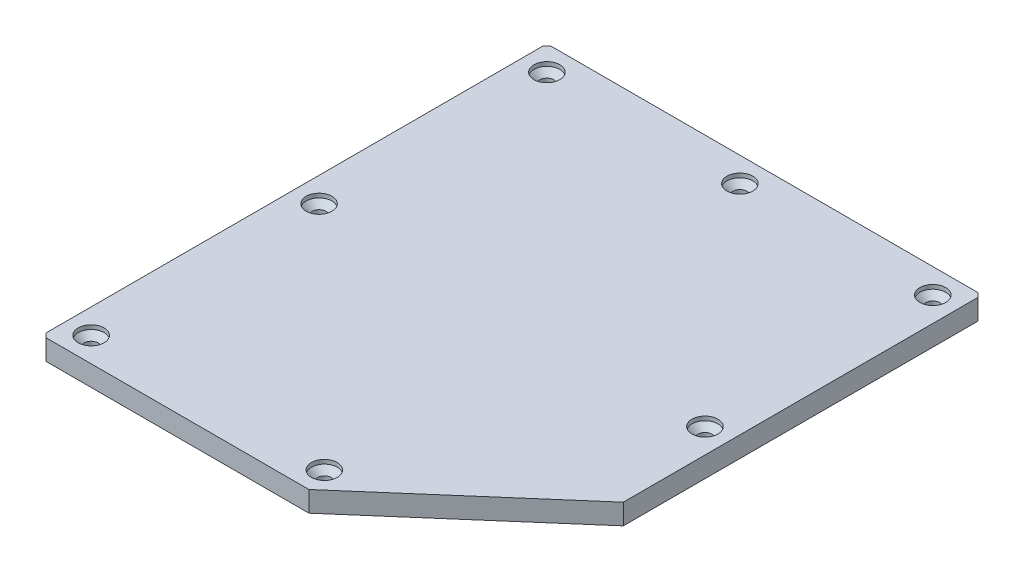
from build123d import *

# Parameters (mm, degrees)
BOSS_EXTRUDE1_DEPTH                          = 5
CSK_FOR_M3_COUNTERSUNK_FLAT_HEAD_SCR_2_COUNT = 2
CSK_FOR_M3_COUNTERSUNK_FLAT_HEAD_SCR_2_PITCH = 47
CSK_FOR_M3_COUNTERSUNK_FLAT_HEAD_SCR_3_COUNT = 2
CSK_FOR_M3_COUNTERSUNK_FLAT_HEAD_SCR_3_PITCH = 94
CSK_FOR_M3_COUNTERSUNK_FLAT_HEAD_SCR_4_COUNT = 2
CSK_FOR_M3_COUNTERSUNK_FLAT_HEAD_SCR_4_PITCH = 109.16157749
CSK_FOR_M3_COUNTERSUNK_FLAT_HEAD_SCR_5_COUNT = 2
CSK_FOR_M3_COUNTERSUNK_FLAT_HEAD_SCR_5_PITCH = 124.687328624
CSK_FOR_M3_COUNTERSUNK_FLAT_HEAD_SCR_6_COUNT = 2
CSK_FOR_M3_COUNTERSUNK_FLAT_HEAD_SCR_6_PITCH = 111
CSK_FOR_M3_COUNTERSUNK_FLAT_HEAD_SCR_7_COUNT = 2
CSK_FOR_M3_COUNTERSUNK_FLAT_HEAD_SCR_7_PITCH = 55.5


with BuildPart() as part:
    # block_perimeter → Boss-Extrude1 (new body)
    with BuildSketch(Plane(origin=(0, 0, 0), x_dir=(1, 0, 0), z_dir=(0, 1, 0))):
        Polygon((52, 60.5), (-52, 60.5), (-53, 59.5), (-53, -61.5), (-52, -62.5), (12.040578429, -62.5), (53, -26.89451804), (53, 59.5), align=None)
    extrude(amount=BOSS_EXTRUDE1_DEPTH)

    # Sketch5 → CSK for M3 Countersunk Flat Head Screw1 (revolve, cut)
    with BuildSketch(Plane(origin=(-47, 5, -54.5), x_dir=(0, 0, 1), z_dir=(1, 0, 0))):
        Polygon((0, 0), (0, 5), (1.7, 5), (1.7, 2.45), (3.15, 1), (3.15, 0), align=None)
    csk_for_m3_countersunk_flat_head_screw1 = revolve(axis=Axis((-47, 11.35, -54.5), (0, -1, 0)), mode=Mode.SUBTRACT)

    # CSK for M3 Countersunk Flat Head Scr 2: CSK for M3 Countersunk Flat Head Screw1 ×2
    with Locations(*[(i * CSK_FOR_M3_COUNTERSUNK_FLAT_HEAD_SCR_2_PITCH, 0, 0) for i in range(1, CSK_FOR_M3_COUNTERSUNK_FLAT_HEAD_SCR_2_COUNT)]):
        add(csk_for_m3_countersunk_flat_head_screw1, mode=Mode.SUBTRACT)

    # CSK for M3 Countersunk Flat Head Scr 3: CSK for M3 Countersunk Flat Head Screw1 ×2
    with Locations(*[(i * CSK_FOR_M3_COUNTERSUNK_FLAT_HEAD_SCR_3_PITCH, 0, 0) for i in range(1, CSK_FOR_M3_COUNTERSUNK_FLAT_HEAD_SCR_3_COUNT)]):
        add(csk_for_m3_countersunk_flat_head_screw1, mode=Mode.SUBTRACT)

    # CSK for M3 Countersunk Flat Head Scr 4: CSK for M3 Countersunk Flat Head Screw1 ×2
    with Locations(*[Vector(0.8611088458210153, 0, 0.508420648330493) * (i * CSK_FOR_M3_COUNTERSUNK_FLAT_HEAD_SCR_4_PITCH) for i in range(1, CSK_FOR_M3_COUNTERSUNK_FLAT_HEAD_SCR_4_COUNT)]):
        add(csk_for_m3_countersunk_flat_head_screw1, mode=Mode.SUBTRACT)

    # CSK for M3 Countersunk Flat Head Scr 5: CSK for M3 Countersunk Flat Head Screw1 ×2
    with Locations(*[Vector(0.4555175812861699, 0, 0.8902267874756397) * (i * CSK_FOR_M3_COUNTERSUNK_FLAT_HEAD_SCR_5_PITCH) for i in range(1, CSK_FOR_M3_COUNTERSUNK_FLAT_HEAD_SCR_5_COUNT)]):
        add(csk_for_m3_countersunk_flat_head_screw1, mode=Mode.SUBTRACT)

    # CSK for M3 Countersunk Flat Head Scr 6: CSK for M3 Countersunk Flat Head Screw1 ×2
    with Locations(*[(0, 0, i * CSK_FOR_M3_COUNTERSUNK_FLAT_HEAD_SCR_6_PITCH) for i in range(1, CSK_FOR_M3_COUNTERSUNK_FLAT_HEAD_SCR_6_COUNT)]):
        add(csk_for_m3_countersunk_flat_head_screw1, mode=Mode.SUBTRACT)

    # CSK for M3 Countersunk Flat Head Scr 7: CSK for M3 Countersunk Flat Head Screw1 ×2
    with Locations(*[(0, 0, i * CSK_FOR_M3_COUNTERSUNK_FLAT_HEAD_SCR_7_PITCH) for i in range(1, CSK_FOR_M3_COUNTERSUNK_FLAT_HEAD_SCR_7_COUNT)]):
        add(csk_for_m3_countersunk_flat_head_screw1, mode=Mode.SUBTRACT)


solid = part.part
